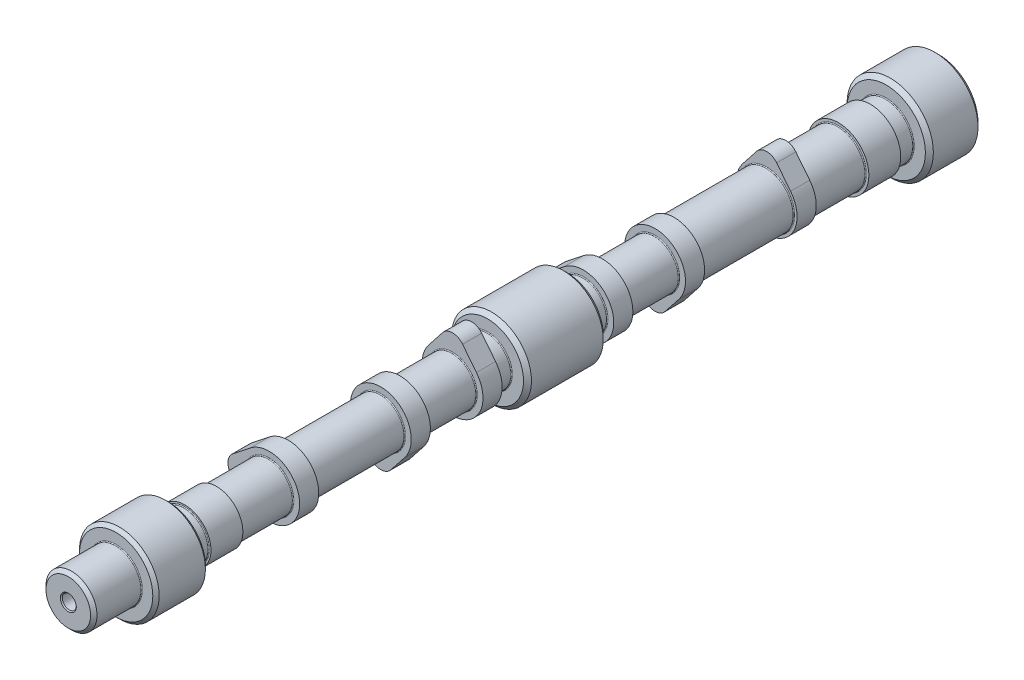
from build123d import *

# Parameters (mm, degrees)
F_12_0_12_DIAMETER_HOLE1_D           = 12
F_12_0_12_DIAMETER_HOLE1_DEPTH       = 15
F_12_0_12_DIAMETER_HOLE1_CSINK_D     = 15.05
F_12_0_12_DIAMETER_HOLE1_CSINK_ANGLE = 90
F_12_0_12_DIAMETER_HOLE1_TIP         = 3.464101615
M10X1_25_TAPPED_HOLE1_D              = 8.8
M10X1_25_TAPPED_HOLE1_DEPTH          = 26.25
M10X1_25_TAPPED_HOLE1_CSINK_D        = 10.05
M10X1_25_TAPPED_HOLE1_CSINK_ANGLE    = 90
M10X1_25_TAPPED_HOLE1_TIP            = 2.643786724
CUT_EXTRUDE1_DEPTH                   = 2.5
BOSS_EXTRUDE2_DEPTH                  = 12
BOSS_EXTRUDE3_REACH                  = 383.923
BOSS_EXTRUDE4_DEPTH                  = 12
BOSS_EXTRUDE5_DEPTH                  = 12
BOSS_EXTRUDE6_DEPTH                  = 12
BOSS_EXTRUDE7_DEPTH                  = 12


with BuildPart() as part:
    # Sketch1 → Revolve1 (revolve)
    with BuildSketch(Plane(origin=(0, 0, 0), x_dir=(0, 0, -1), z_dir=(1, 0, 0)), mode=Mode.PRIVATE) as revolve1_sk:
        with BuildLine():
            Line((0, 0), (0, 14))
            Line((0, 14), (2, 16))
            Line((2, 16), (29.5, 16))
            ThreePointArc((29.5, 16), (29.853553391, 16.146446609), (30, 16.5))
            Line((30, 16.5), (30, 23))
            Line((30, 23), (32, 25))
            Line((32, 25), (61, 25))
            Line((61, 25), (63, 23))
            Line((63, 23), (63, 15.5))
            ThreePointArc((63, 15.5), (63.146446609, 15.146446609), (63.5, 15))
            Line((63.5, 15), (72.5, 15))
            ThreePointArc((72.5, 15), (72.853553391, 15.146446609), (73, 15.5))
            Line((73, 15.5), (73, 16.5))
            Line((73, 16.5), (93, 16.5))
            Line((93, 16.5), (93, 15.5))
            ThreePointArc((93, 15.5), (93.146446609, 15.146446609), (93.5, 15))
            Line((93.5, 15), (125.5, 15))
            ThreePointArc((125.5, 15), (125.853553391, 15.146446609), (126, 15.5))
            Line((126, 15.5), (126, 17.0516083))
            Line((126, 17.0516083), (138, 17.0516083))
            Line((138, 17.0516083), (138, 15.5))
            ThreePointArc((138, 15.5), (138.146446609, 15.146446609), (138.5, 15))
            Line((138.5, 15), (195.5, 15))
            ThreePointArc((195.5, 15), (195.853553391, 15.146446609), (196, 15.5))
            Line((196, 15.5), (196, 17.0516083))
            Line((196, 17.0516083), (208, 17.0516083))
            Line((208, 17.0516083), (208, 15.5))
            ThreePointArc((208, 15.5), (208.146446609, 15.146446609), (208.5, 15))
            Line((208.5, 15), (240.5, 15))
            ThreePointArc((240.5, 15), (240.853553391, 15.146446609), (241, 15.5))
            Line((241, 15.5), (241, 17.0516083))
            Line((241, 17.0516083), (253, 17.0516083))
            Line((253, 17.0516083), (253, 15.5))
            ThreePointArc((253, 15.5), (253.146446609, 15.146446609), (253.5, 15))
            Line((253.5, 15), (262.5, 15))
            ThreePointArc((262.5, 15), (262.853553391, 15.146446609), (263, 15.5))
            Line((263, 15.5), (263, 22.5))
            Line((263, 22.5), (265.5, 25))
            Line((265.5, 25), (310.5, 25))
            Line((310.5, 25), (313, 22.5))
            Line((313, 22.5), (313, 15.5))
            ThreePointArc((313, 15.5), (313.146446609, 15.146446609), (313.5, 15))
            Line((313.5, 15), (322.5, 15))
            ThreePointArc((322.5, 15), (322.853553391, 15.146446609), (323, 15.5))
            Line((323, 15.5), (323, 17.0516083))
            Line((323, 17.0516083), (335, 17.0516083))
            Line((335, 17.0516083), (335, 15.5))
            ThreePointArc((335, 15.5), (335.146446609, 15.146446609), (335.5, 15))
            Line((335.5, 15), (367.500465535, 15))
            ThreePointArc((367.500465535, 15), (367.853854219, 15.14628198), (368.000465318, 15.499534249))
            Line((368.000465318, 15.499534249), (368.00381147, 19.091740524))
            Line((368.00381147, 19.091740524), (380.00381147, 19.091740524))
            Line((380.00381147, 19.091740524), (380.00381147, 17.540132224))
            ThreePointArc((380.00381147, 17.540132224), (380.150258079, 17.186578833), (380.50381147, 17.040132224))
            Line((380.50381147, 17.040132224), (437.50381147, 17.040132224))
            ThreePointArc((437.50381147, 17.040132224), (437.85736486, 17.186578833), (438.00381147, 17.540132224))
            Line((438.00381147, 17.540132224), (438.00381147, 19.091740524))
            Line((438.00381147, 19.091740524), (450.00381147, 19.091740524))
            Line((450.00381147, 19.091740524), (450.00381147, 17.540132224))
            ThreePointArc((450.00381147, 17.540132224), (450.150258079, 17.186578833), (450.50381147, 17.040132224))
            Line((450.50381147, 17.040132224), (482.50381147, 17.040132224))
            ThreePointArc((482.50381147, 17.040132224), (482.85736486, 17.186578833), (483.00381147, 17.540132224))
            Line((483.00381147, 17.540132224), (483.00381147, 19.091740524))
            Line((483.00381147, 19.091740524), (503.00381147, 19.091740524))
            Line((503.00381147, 19.091740524), (503.00381147, 17.540132224))
            ThreePointArc((503.00381147, 17.540132224), (503.150258079, 17.186578833), (503.50381147, 17.040132224))
            Line((503.50381147, 17.040132224), (512.50381147, 17.040132224))
            ThreePointArc((512.50381147, 17.040132224), (512.85736486, 17.186578833), (513.00381147, 17.540132224))
            Line((513.00381147, 17.540132224), (513.00381147, 24.540132224))
            Line((513.00381147, 24.540132224), (515.50381147, 27.040132224))
            Line((515.50381147, 27.040132224), (543.50381147, 27.040132224))
            Line((543.50381147, 27.040132224), (546.00381147, 24.540132224))
            Line((546.00381147, 24.540132224), (546.00381147, 0))
            Line((546.00381147, 0), (0, 0))
        make_face()
    revolve(revolve1_sk.sketch.rotate(Axis((0, 0, 0), (0, 0, -1)), 90), axis=Axis((0, 0, 0), (0, 0, -1)))

    # Ø12.0 (12) Diameter Hole1
    with Locations(Plane(origin=(0, 0, -546.00381147), x_dir=(-1, 0, 0), z_dir=(0, 0, -1))):
        with Locations((0, 0)):
            CounterSinkHole(F_12_0_12_DIAMETER_HOLE1_D / 2, F_12_0_12_DIAMETER_HOLE1_CSINK_D / 2, depth=F_12_0_12_DIAMETER_HOLE1_DEPTH, counter_sink_angle=F_12_0_12_DIAMETER_HOLE1_CSINK_ANGLE)
            with Locations((0, 0, -(F_12_0_12_DIAMETER_HOLE1_DEPTH + F_12_0_12_DIAMETER_HOLE1_TIP / 2))):  # 120° drill point
                Cone(0, F_12_0_12_DIAMETER_HOLE1_D / 2, F_12_0_12_DIAMETER_HOLE1_TIP, mode=Mode.SUBTRACT)

    # M10x1.25 Tapped Hole1
    with Locations(Plane.XY):
        with Locations((0, 0)):
            CounterSinkHole(M10X1_25_TAPPED_HOLE1_D / 2, M10X1_25_TAPPED_HOLE1_CSINK_D / 2, depth=M10X1_25_TAPPED_HOLE1_DEPTH, counter_sink_angle=M10X1_25_TAPPED_HOLE1_CSINK_ANGLE)
            with Locations((0, 0, -(M10X1_25_TAPPED_HOLE1_DEPTH + M10X1_25_TAPPED_HOLE1_TIP / 2))):  # 118° drill point
                Cone(0, M10X1_25_TAPPED_HOLE1_D / 2, M10X1_25_TAPPED_HOLE1_TIP, mode=Mode.SUBTRACT)

    # Sketch7 → Cut-Extrude1 (cut, symmetric)
    with BuildSketch(Plane(origin=(0, 0, 0), x_dir=(0, 0, -1), z_dir=(1, 0, 0))):
        with BuildLine():
            Line((2.205046427, -16), (26.205046427, -16))
            ThreePointArc((26.205046427, -16), (14.205046427, -10), (2.205046427, -16))
        make_face()
    extrude(amount=CUT_EXTRUDE1_DEPTH, both=True, mode=Mode.SUBTRACT)

    # Sketch8 → Boss-Extrude2 (add)
    with BuildSketch(Plane(origin=(0, 0, -450.00381147), x_dir=(-1, 0, 0), z_dir=(0, 0, -1))):
        with BuildLine():
            Line((-6.28082844, 22.863175631), (-14.988993357, 11.824746695))
            ThreePointArc((-14.988993357, 11.824746695), (0, -19.091740524), (14.988993357, 11.824746695))
            Line((14.988993357, 11.824746695), (6.28082844, 22.863175631))
            ThreePointArc((6.28082844, 22.863175631), (0, 25.908259476), (-6.28082844, 22.863175631))
        make_face()
    extrude(amount=-BOSS_EXTRUDE2_DEPTH)

    # Boss-Extrude3: up to this cone (the profile starts inside it)
    boss_extrude3_end = Plane(origin=(0, 0, -380.003811), z_dir=(0, 0, -1)).offset(-12.017782549) * Cone(0.001073534, 14275778.106079647, 13297.934227361, align=(Align.CENTER, Align.CENTER, Align.MIN), mode=Mode.PRIVATE)
    # Sketch9 → Boss-Extrude3 (add, up to the surface)
    with BuildSketch(Plane(origin=(0, 0, -380.00381147), x_dir=(-1, 0, 0), z_dir=(0, 0, -1)), mode=Mode.PRIVATE) as boss_extrude3_sk1:
        with BuildLine():
            Line((6.28082844, -22.863175631), (14.988993357, -11.824746695))
            ThreePointArc((14.988993357, -11.824746695), (0, 19.091740524), (-14.988993357, -11.824746695))
            Line((-14.988993357, -11.824746695), (-6.28082844, -22.863175631))
            ThreePointArc((-6.28082844, -22.863175631), (0, -25.908259476), (6.28082844, -22.863175631))
        make_face()
    boss_extrude3_tool1 = extrude(boss_extrude3_sk1.sketch, amount=-BOSS_EXTRUDE3_REACH, mode=Mode.PRIVATE) & boss_extrude3_end
    add(boss_extrude3_tool1.solids().sort_by_distance((0, -1.827435, -380.003811))[0])

    # Sketch10 → Boss-Extrude4 (add)
    with BuildSketch(Plane(origin=(0, 0, -335), x_dir=(-1, 0, 0), z_dir=(0, 0, -1))):
        with BuildLine():
            Line((22.863175631, 6.28082844), (11.824746695, 14.988993357))
            ThreePointArc((11.824746695, 14.988993357), (-19.091740524, 0), (11.824746695, -14.988993357))
            Line((11.824746695, -14.988993357), (22.863175631, -6.28082844))
            ThreePointArc((22.863175631, -6.28082844), (25.908259476, 0), (22.863175631, 6.28082844))
        make_face()
    extrude(amount=-BOSS_EXTRUDE4_DEPTH)

    # Sketch11 → Boss-Extrude5 (add)
    with BuildSketch(Plane(origin=(0, 0, -253), x_dir=(-1, 0, 0), z_dir=(0, 0, -1))):
        with BuildLine():
            Line((-6.28082844, 22.863175631), (-14.988993357, 11.824746695))
            ThreePointArc((-14.988993357, 11.824746695), (0, -19.091740524), (14.988993357, 11.824746695))
            Line((14.988993357, 11.824746695), (6.28082844, 22.863175631))
            ThreePointArc((6.28082844, 22.863175631), (0, 25.908259476), (-6.28082844, 22.863175631))
        make_face()
    extrude(amount=-BOSS_EXTRUDE5_DEPTH)

    # Sketch12 → Boss-Extrude6 (add)
    with BuildSketch(Plane(origin=(0, 0, -208), x_dir=(-1, 0, 0), z_dir=(0, 0, -1))):
        with BuildLine():
            Line((6.28082844, -22.863175631), (14.988993357, -11.824746695))
            ThreePointArc((14.988993357, -11.824746695), (0, 19.091740524), (-14.988993357, -11.824746695))
            Line((-14.988993357, -11.824746695), (-6.28082844, -22.863175631))
            ThreePointArc((-6.28082844, -22.863175631), (0, -25.908259476), (6.28082844, -22.863175631))
        make_face()
    extrude(amount=-BOSS_EXTRUDE6_DEPTH)

    # Sketch13 → Boss-Extrude7 (add)
    with BuildSketch(Plane(origin=(0, 0, -138), x_dir=(-1, 0, 0), z_dir=(0, 0, -1))):
        with BuildLine():
            Line((22.863175631, 6.28082844), (11.824746695, 14.988993357))
            ThreePointArc((11.824746695, 14.988993357), (-19.091740524, 0), (11.824746695, -14.988993357))
            Line((11.824746695, -14.988993357), (22.863175631, -6.28082844))
            ThreePointArc((22.863175631, -6.28082844), (25.908259476, 0), (22.863175631, 6.28082844))
        make_face()
    extrude(amount=-BOSS_EXTRUDE7_DEPTH)


solid = part.part
